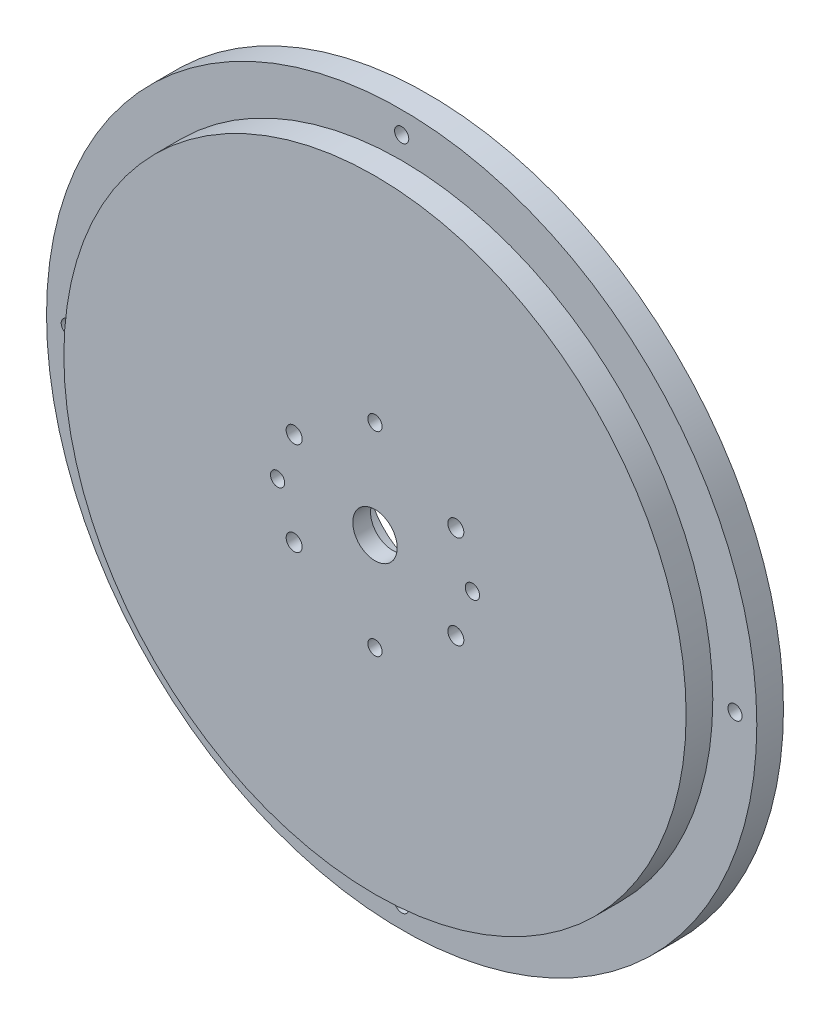
from build123d import *

# Parameters (mm, degrees)
SKETCH_1_R          = 70
EXTRUDE_1_DEPTH     = 12
SKETCH_2_R          = 79.9
EXTRUDE_2_DEPTH     = 6
SKETCH_3_R          = 1.6
CUT_EXTRUDE_1_DEPTH = 10
SKETCH_4_R          = 1.6
CUT_EXTRUDE_2_DEPTH = 20
SKETCH_4_5_R        = 1.6
CUT_EXTRUDE_3_DEPTH = 20
SKETCH_6_R          = 5
CUT_EXTRUDE_5_DEPTH = 20
SKETCH_7_R          = 1.8
CUT_EXTRUDE_8_DEPTH = 30
SKETCH_10_R         = 14
CUT_EXTRUDE_9_DEPTH = 8


with BuildPart() as part:
    # 草图1 → 凸台-拉伸1 (new body)
    with BuildSketch(Plane.XY):
        Circle(SKETCH_1_R)
    extrude(amount=EXTRUDE_1_DEPTH)

    # 草图2 → 凸台-拉伸2 (add)
    with BuildSketch(Plane.XY):
        Circle(SKETCH_2_R)
    extrude(amount=EXTRUDE_2_DEPTH)

    # 草图3 → 切除-拉伸1 (cut)
    with BuildSketch(Plane.XY):
        with Locations((-75, 0)):
            Circle(SKETCH_3_R)
        with Locations((75, 0)):
            Circle(SKETCH_3_R)
        with Locations((0, -75)):
            Circle(SKETCH_3_R)
        with Locations((0, 75)):
            Circle(SKETCH_3_R)
    extrude(amount=CUT_EXTRUDE_1_DEPTH, mode=Mode.SUBTRACT)

    # 草图4 → 切除-拉伸2 (cut)
    with BuildSketch(Plane(origin=(0, 0, 0), x_dir=(-1, 0, 0), z_dir=(0, 0, -1))):
        with Locations((0, -21.9203)):
            Circle(SKETCH_4_R)
    extrude(amount=-CUT_EXTRUDE_2_DEPTH, mode=Mode.SUBTRACT)

    # 草图4<5> → 切除-拉伸3 (cut)
    with BuildSketch(Plane(origin=(0, 0, 0), x_dir=(-1, 0, 0), z_dir=(0, 0, -1))):
        with Locations((-21.9203, 0)):
            Circle(SKETCH_4_5_R)
        with Locations((0, 21.9203)):
            Circle(SKETCH_4_5_R)
        with Locations((21.9203, 0)):
            Circle(SKETCH_4_5_R)
        with Locations((0, -21.9203)):
            Circle(SKETCH_4_5_R)
    extrude(amount=-CUT_EXTRUDE_3_DEPTH, mode=Mode.SUBTRACT)

    # 草图6 → 切除-拉伸5 (cut)
    with BuildSketch(Plane(origin=(0, 0, 0), x_dir=(-1, 0, 0), z_dir=(0, 0, -1))):
        Circle(SKETCH_6_R)
    extrude(amount=-CUT_EXTRUDE_5_DEPTH, mode=Mode.SUBTRACT)

    # 草图7 → 切除-拉伸8 (cut)
    with BuildSketch(Plane(origin=(0, 0, 0), x_dir=(-1, 0, 0), z_dir=(0, 0, -1))):
        with Locations((-18.186533479, 10.5)):
            Circle(SKETCH_7_R)
        with Locations((18.186533479, 10.5)):
            Circle(SKETCH_7_R)
        with Locations((18.186533479, -10.5)):
            Circle(SKETCH_7_R)
        with Locations((-18.186533479, -10.5)):
            Circle(SKETCH_7_R)
    extrude(amount=-CUT_EXTRUDE_8_DEPTH, mode=Mode.SUBTRACT)

    # 草图10 → 切除-拉伸9 (cut)
    with BuildSketch(Plane(origin=(0, 0, 0), x_dir=(-1, 0, 0), z_dir=(0, 0, -1))):
        Circle(SKETCH_10_R)
    extrude(amount=-CUT_EXTRUDE_9_DEPTH, mode=Mode.SUBTRACT)


solid = part.part
